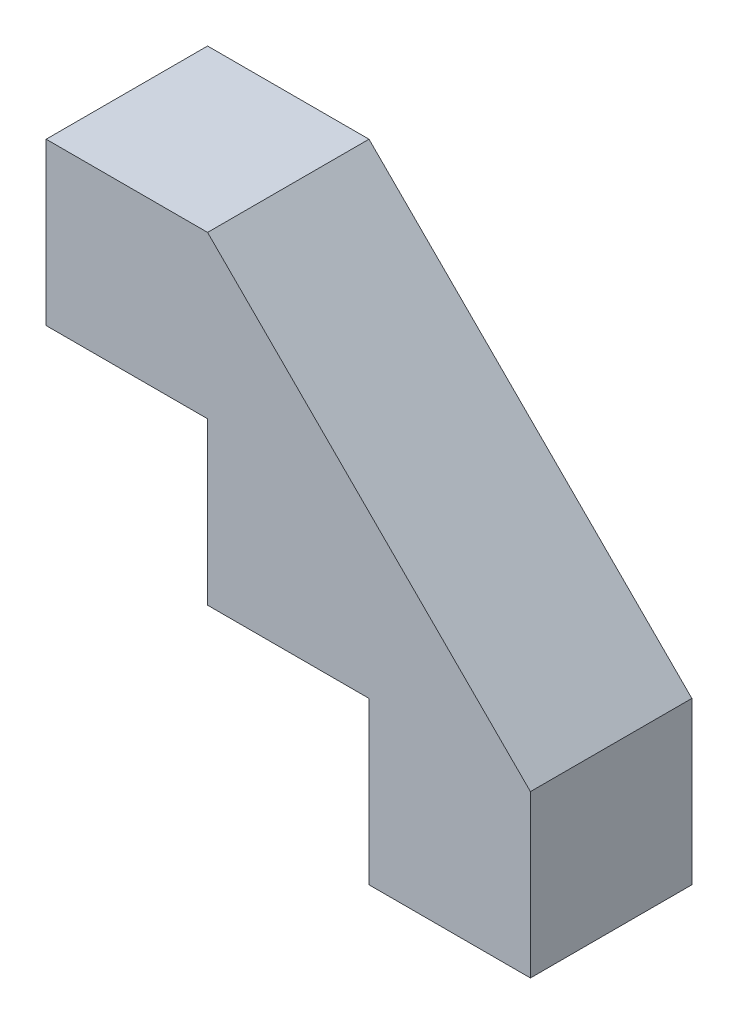
from build123d import *

# Parameters (mm, degrees)
BOSS_EXTRUDE1_DEPTH = 3


with BuildPart() as part:
    # Sketch1 → Boss-Extrude1 (new body)
    with BuildSketch(Plane.XY):
        Polygon((0, 0), (0, 3), (-3, 3), (-3, 6), (0, 6), (6, 0), (6, -3), (3, -3), (3, 0), align=None)
    extrude(amount=BOSS_EXTRUDE1_DEPTH)


solid = part.part
